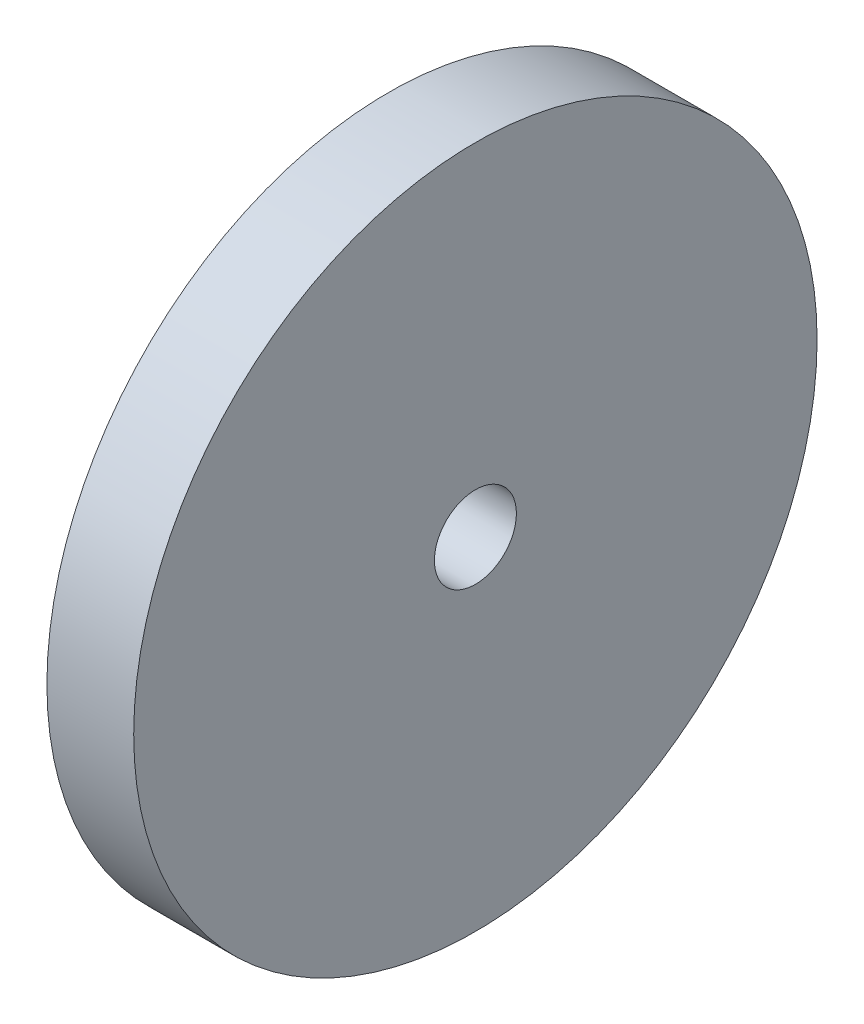
from build123d import *

# Parameters (mm, degrees)
SKETCH1_R           = 50
SKETCH1_R_2         = 6
BOSS_EXTRUDE1_DEPTH = 12.7


with BuildPart() as part:
    # Sketch1 → Boss-Extrude1 (new body)
    with BuildSketch(Plane(origin=(0, 0, 0), x_dir=(0, 0, -1), z_dir=(1, 0, 0))):
        Circle(SKETCH1_R)
        Circle(SKETCH1_R_2, mode=Mode.SUBTRACT)
    extrude(amount=BOSS_EXTRUDE1_DEPTH)


solid = part.part
